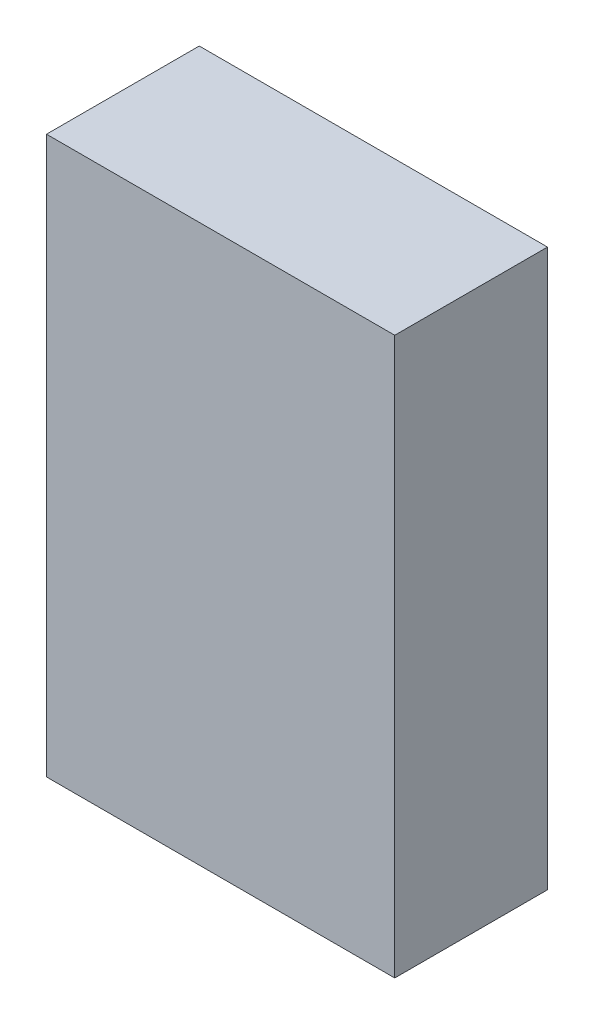
from build123d import *

# Parameters (mm, degrees)
SKETCH_1_W          = 87.41993269
SKETCH_1_H          = 142.13
EXTRUDE_1_DEPTH     = 2
SKETCH_3_W          = 91.41993269
SKETCH_3_H          = 146.13
SKETCH_3_W_2        = 87.41993269
SKETCH_3_H_2        = 142.13
EXTRUDE_2_DEPTH     = 40.1
CUT_EXTRUDE_1_REACH = 166.86
SKETCH_4_W          = 27.46
SKETCH_4_H          = 8.31
SKETCH_4_W_2        = 17.9
SKETCH_4_H_2        = 4


with BuildPart() as part:
    # 草图1 → 凸台-拉伸1 (new body)
    with BuildSketch(Plane.XY):
        with Locations((20.419966345, 50.685)):
            Rectangle(SKETCH_1_W, SKETCH_1_H)
    extrude(amount=EXTRUDE_1_DEPTH)

    # 草图3 → 凸台-拉伸2 (add)
    with BuildSketch(Plane.XY.offset(2)):
        with Locations((20.419966345, 50.685)):
            Rectangle(SKETCH_3_W, SKETCH_3_H)
        with Locations((20.419966345, 50.685)):
            Rectangle(SKETCH_3_W_2, SKETCH_3_H_2, mode=Mode.SUBTRACT)
    extrude(amount=-EXTRUDE_2_DEPTH)

    # 草图4 → 切除-拉伸1 (cut, up to next)
    with BuildSketch(Plane.XZ.offset(22.38), mode=Mode.PRIVATE) as cut_extrude_1_sk1:
        with Locations((0, -19.755)):
            Rectangle(SKETCH_4_W, SKETCH_4_H)
    cut_extrude_1_tool1 = extrude(cut_extrude_1_sk1.sketch, amount=-CUT_EXTRUDE_1_REACH, mode=Mode.PRIVATE) & part.part
    # 草图4 → 切除-拉伸1 (cut, up to next)
    with BuildSketch(Plane.XZ.offset(22.38), mode=Mode.PRIVATE) as cut_extrude_1_sk2:
        with Locations((-7, -2)):
            Rectangle(SKETCH_4_W_2, SKETCH_4_H_2)
    cut_extrude_1_tool2 = extrude(cut_extrude_1_sk2.sketch, amount=-CUT_EXTRUDE_1_REACH, mode=Mode.PRIVATE) & part.part
    # 草图4 → 切除-拉伸1 (cut, up to next)
    with BuildSketch(Plane.XZ.offset(22.38), mode=Mode.PRIVATE) as cut_extrude_1_sk3:
        with BuildLine():
            ThreePointArc((31.896666667, -17.416256273), (20.58, -19.755), (31.896666667, -22.093743727))
            ThreePointArc((31.896666667, -22.093743727), (35.28, -19.755), (31.896666667, -17.416256273))
        make_face()
    cut_extrude_1_tool3 = extrude(cut_extrude_1_sk3.sketch, amount=-CUT_EXTRUDE_1_REACH, mode=Mode.PRIVATE) & part.part
    add(cut_extrude_1_tool1.solids().sort_by_distance((0, -22.38, -19.755))[0], mode=Mode.SUBTRACT)
    add(cut_extrude_1_tool2.solids().sort_by_distance((-7, -22.38, -2))[0], mode=Mode.SUBTRACT)
    add(cut_extrude_1_tool3.solids().sort_by_distance((27.210327, -22.38, -19.755))[0], mode=Mode.SUBTRACT)


solid = part.part
